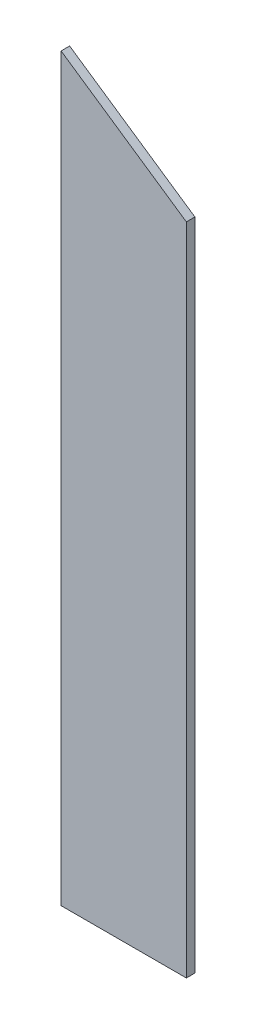
from build123d import *

# Parameters (mm, degrees)
RESSALTO_EXTRUS_O1_DEPTH = 15


with BuildPart() as part:
    # Esboço1 → Ressalto-extrusão1 (new body)
    with BuildSketch(Plane.XY):
        Polygon((-110, 650), (-110, -650), (110, -650), (110, 500), align=None)
    extrude(amount=RESSALTO_EXTRUS_O1_DEPTH)


solid = part.part
